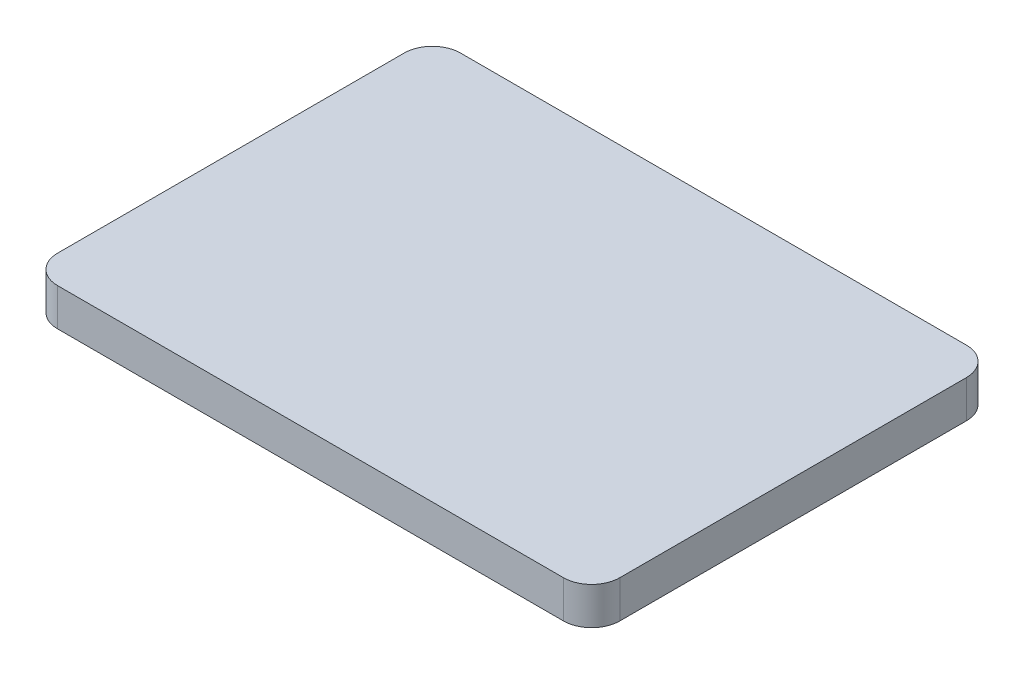
from build123d import *

# Parameters (mm, degrees)
SKETCH_1_W      = 60
SKETCH_1_H      = 43
EXTRUDE_1_DEPTH = 4
FILLET_1_R      = 3


with BuildPart() as part:
    # ｽｹｯﾁ1 → ﾎﾞｽ - 押し出し1 (new body)
    with BuildSketch(Plane(origin=(0, 0, 0), x_dir=(1, 0, 0), z_dir=(0, 1, 0))):
        with Locations((30, 21.5)):
            Rectangle(SKETCH_1_W, SKETCH_1_H)
    extrude(amount=EXTRUDE_1_DEPTH)

    # ﾌｨﾚｯﾄ1
    fillet_1_edges = [part.edges().sort_by_distance(p)[0] for p in [
        (0, 2, -43),
        (60, 2, -43),
        (60, 2, 0),
        (0, 2, 0),
    ]]
    fillet(fillet_1_edges, radius=FILLET_1_R)


solid = part.part
